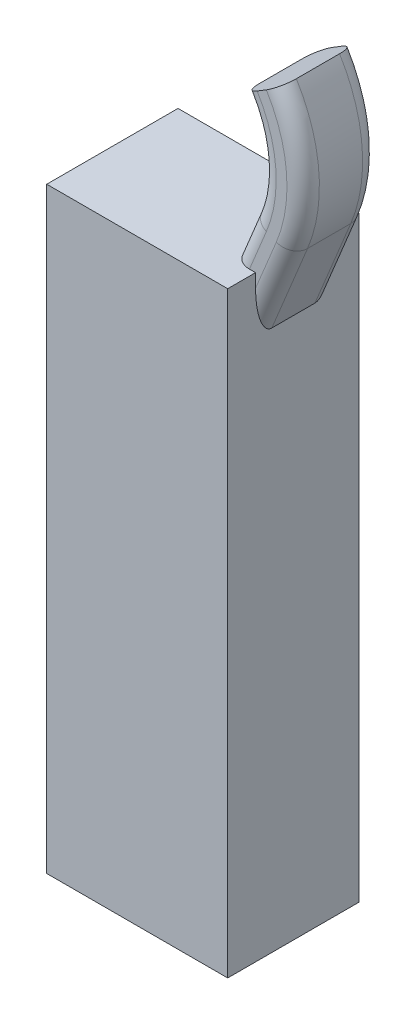
from build123d import *

# Parameters (mm, degrees)
SKETCH1_W   = 33.5
SKETCH1_H   = 110.5
BODY_DEPTH  = 12.15
CABLE_DEPTH = 7
FILLET1_R   = 3


with BuildPart() as part:
    # Sketch1 → Body (new, symmetric)
    with BuildSketch(Plane.XY):
        Rectangle(SKETCH1_W, SKETCH1_H)
    extrude(amount=BODY_DEPTH, both=True)

    # Sketch2 → Cable (add, symmetric)
    with BuildSketch(Plane.XY):
        with BuildLine():
            Line((14.614768377, 39.692127969), (23.378177187, 60.932254406))
            ThreePointArc((23.378177187, 60.932254406), (25.480222235, 74.274540457), (21.310589844, 87.121694079))
            Line((21.310589844, 87.121694079), (14.485707158, 82.94784977))
            ThreePointArc((14.485707158, 82.94784977), (17.505037046, 73.644920573), (15.98289628, 63.98345422))
            Line((15.98289628, 63.98345422), (7.21948747, 42.743327783))
            Line((7.21948747, 42.743327783), (14.614768377, 39.692127969))
        make_face()
    extrude(amount=CABLE_DEPTH, both=True)

    # Fillet1
    fillet1_edges = [part.edges().sort_by_distance(p)[0] for p in [
        (20.064088593, 52.899802391, -7),
        (14.18123964, 59.61672711, 7),
        (20.064088593, 52.899802391, 7),
        (25.480222235, 74.274540457, 7),
        (14.18123964, 59.61672711, -7),
        (17.505037046, 73.644920573, -7),
        (25.480222235, 74.274540457, -7),
        (17.505037046, 73.644920573, 7),
    ]]
    fillet(fillet1_edges, radius=FILLET1_R)


solid = part.part
